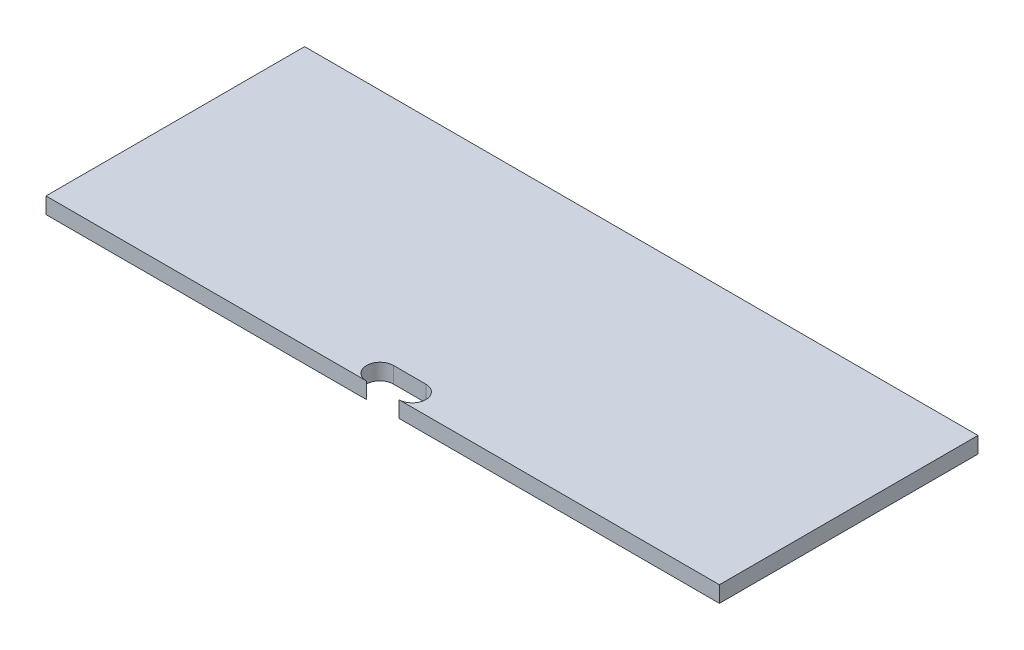
from build123d import *

# Parameters (mm, degrees)
SKETCH1_W           = 125
SKETCH1_H           = 48
BOSS_EXTRUDE1_DEPTH = 3
CUT_EXTRUDE1_DEPTH  = 3


with BuildPart() as part:
    # Sketch1 → Boss-Extrude1 (new body)
    with BuildSketch(Plane(origin=(0, 0, 0), x_dir=(1, 0, 0), z_dir=(0, 1, 0))):
        Rectangle(SKETCH1_W, SKETCH1_H)
    extrude(amount=BOSS_EXTRUDE1_DEPTH)

    # Sketch2 → Cut-Extrude1 (cut)
    with BuildSketch(Plane(origin=(0, 3, 0), x_dir=(1, 0, 0), z_dir=(0, 1, 0))):
        with BuildLine():
            Line((0, -19), (3, -19))
            ThreePointArc((3, -19), (5.5, -21.5), (3, -24))
            Line((3, -24), (-3, -24))
            ThreePointArc((-3, -24), (-5.5, -21.5), (-3, -19))
            Line((-3, -19), (0, -19))
        make_face()
    extrude(amount=-CUT_EXTRUDE1_DEPTH, mode=Mode.SUBTRACT)


solid = part.part
